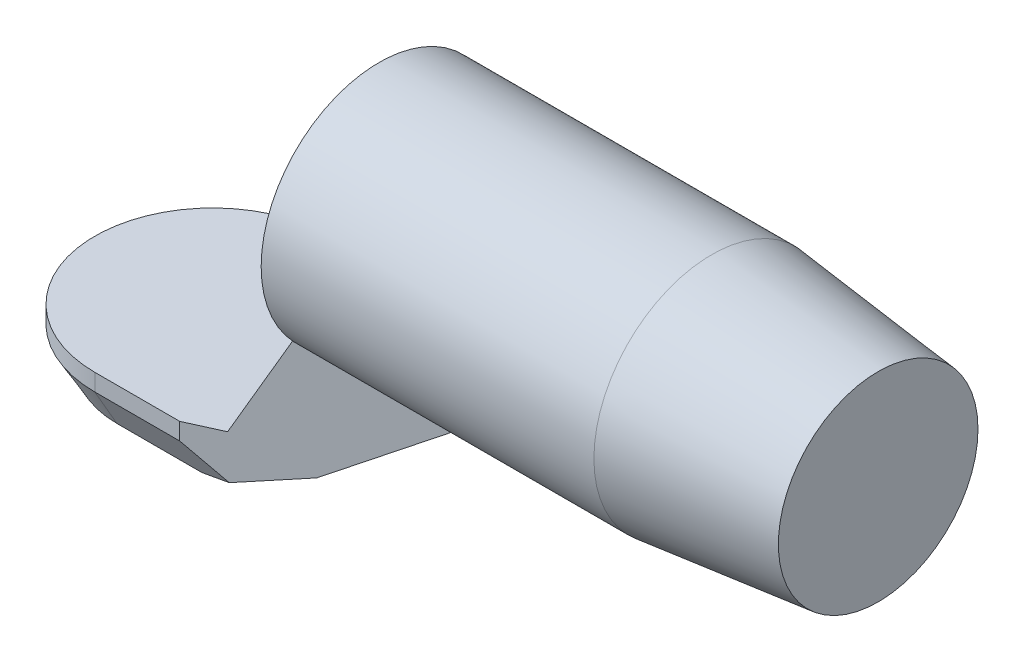
from build123d import *

# Parameters (mm, degrees)
SKETCH2_R                = 27
SKETCH1_R                = 22.86
BOSS_EXTRUDE3_DEPTH      = 27
BOSS_EXTRUDE3_DEPTH_BACK = 27
CUT_EXTRUDE1_DEPTH       = 194.396897645
CUT_EXTRUDE1_DEPTH_BACK  = 194.396897645
SKETCH3_R                = 27
BOSS_EXTRUDE1_DEPTH      = 76.2
CUT_EXTRUDE5_DEPTH       = 194.396897645
CHAMFER1_SIZE            = 5.08
CHAMFER1_SIZE2           = 8.798818102


with BuildPart() as part:
    # Sketch2 → Loft1 section 0
    with BuildSketch(Plane(origin=(-38.1, 0, 0), x_dir=(0, 0, -1), z_dir=(1, 0, 0))):
        Circle(SKETCH2_R)
    # Sketch1 → Loft1 section 1
    with BuildSketch(Plane(origin=(0, 0, 0), x_dir=(0, 0, -1), z_dir=(1, 0, 0))):
        Circle(SKETCH1_R)
    loft()

    # Sketch3 → Boss-Extrude1 (add)
    with BuildSketch(Plane.ZY.offset(38.1)):
        with Locations(Location((0, 0, 0), (0, 0, 180))):
            Circle(SKETCH3_R)
    extrude(amount=BOSS_EXTRUDE1_DEPTH)


with BuildPart() as body_2:
    # Sketch5 → Boss-Extrude3 (new, two sides: drawn at the far end of the back side and taken through both)
    with BuildSketch(Plane.XY.offset(-BOSS_EXTRUDE3_DEPTH_BACK)):
        Polygon((-179.4, -52.7), (-132.943113445, -52.7), (-111.349334982, -45.315756873), (-73.760134446, -19.026311402), (-101.191412815, 9.117290663), (-125.4, -40), (-179.4, -40), align=None)
    extrude(amount=BOSS_EXTRUDE3_DEPTH + BOSS_EXTRUDE3_DEPTH_BACK)

    # Sketch6 → Cut-Extrude1 (cut, two sides: drawn at the far end of the back side and taken through both)
    with BuildSketch(Plane(origin=(0, -40, 0), x_dir=(1, 0, 0), z_dir=(0, 1, 0)).offset(-CUT_EXTRUDE1_DEPTH_BACK)):
        with BuildLine():
            Line((-86.250527187, 5.848904512), (-132.943113445, 27))
            Line((-132.943113445, 27), (-91.242806862, 97.749897972))
            Line((-91.242806862, 97.749897972), (-57.269689533, 82.016741592))
            Line((-57.269689533, 82.016741592), (-73.59167625, -70.746058769))
            Line((-73.59167625, -70.746058769), (-96.605806247, -77.573084602))
            Line((-96.605806247, -77.573084602), (-132.943113445, -27))
            Line((-132.943113445, -27), (-86.250527187, -5.848904512))
            ThreePointArc((-86.250527187, -5.848904512), (-82.478988384, 0), (-86.250527187, 5.848904512))
        make_face()
    extrude(amount=CUT_EXTRUDE1_DEPTH + CUT_EXTRUDE1_DEPTH_BACK, mode=Mode.SUBTRACT)

    # Sketch7 → Cut-Extrude5 (cut, through all)
    with BuildSketch(Plane(origin=(0, -40, 0), x_dir=(1, 0, 0), z_dir=(0, 1, 0))):
        Polygon((-179.4, 27), (-152.4, 27), (-158.750236272, 40.690106542), (-204.252102954, 19.583798613), (-213.553043532, -44.478540914), (-177.8, -47.533614603), (-152.4, -27), (-179.4, -27), (-179.4, 0), align=None)
        with BuildLine():
            ThreePointArc((-179.4, 0), (-171.491883092, 19.091883092), (-152.4, 27))
            Line((-152.4, 27), (-179.4, 27))
            Line((-179.4, 27), (-179.4, 0))
        make_face()
        with BuildLine():
            ThreePointArc((-152.4, -27), (-171.491883092, -19.091883092), (-179.4, 0))
            Line((-179.4, 0), (-179.4, -27))
            Line((-179.4, -27), (-152.4, -27))
        make_face()
    extrude(amount=-CUT_EXTRUDE5_DEPTH, mode=Mode.SUBTRACT)

    # Chamfer1
    chamfer1_edges = [body_2.edges().sort_by_distance(p)[0] for p in [
        (-142.671556723, -52.7, 27),
        (-142.671556723, -52.7, -27),
        (-179.4, -52.7, 0),
    ]]
    chamfer1_side = [body_2.faces().sort_by_distance(p)[0] for p in [
        (-153.720986212, -52.7, 0),
    ]]
    chamfer(chamfer1_edges, length=CHAMFER1_SIZE, length2=CHAMFER1_SIZE2, reference=chamfer1_side[0])


solid = Compound([part.part, body_2.part])
